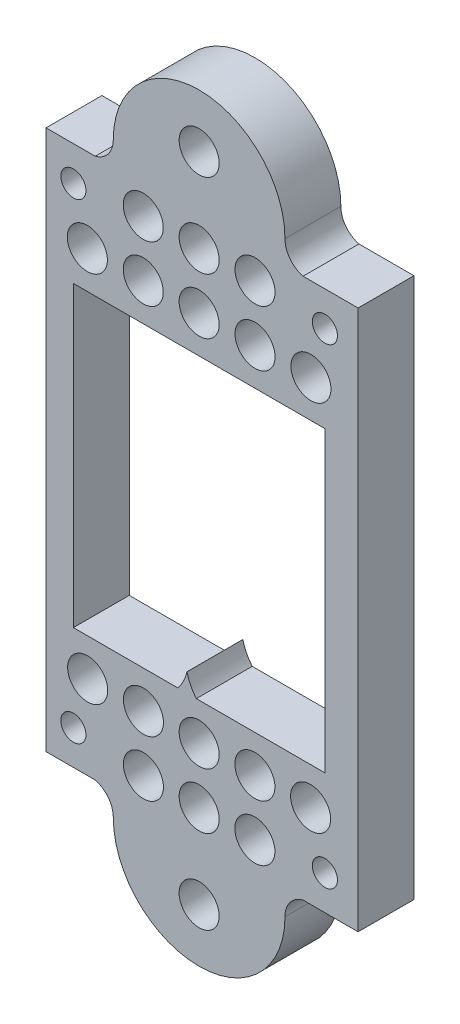
from build123d import *

# Parameters (mm, degrees)
SKETCH1_R           = 1.35
SKETCH1_R_2         = 2.15
BOSS_EXTRUDE1_DEPTH = 6
SKETCH2_R           = 2.15
CUT_EXTRUDE1_DEPTH  = 4.2


with BuildPart() as part:
    # Sketch1 → Boss-Extrude1 (new body)
    with BuildSketch(Plane.XY):
        with BuildLine():
            Line((-16.436457619, 29), (-11.155935204, 29))
            ThreePointArc((-11.155935204, 29), (-9.748616749, 29.926511277), (-9.214880919, 31.524664725))
            ThreePointArc((-9.214880919, 31.524664725), (0, 40.739545643), (9.214880919, 31.524664725))
            ThreePointArc((9.214880919, 31.524664725), (9.748616749, 29.926511277), (11.155935204, 29))
            Line((11.155935204, 29), (17.063542381, 29))
            Line((17.063542381, 29), (17.063542381, -29))
            Line((17.063542381, -29), (11.155935204, -29))
            ThreePointArc((11.155935204, -29), (9.748616749, -29.926511277), (9.214880919, -31.524664725))
            ThreePointArc((9.214880919, -31.524664725), (0, -40.739545643), (-9.214880919, -31.524664725))
            ThreePointArc((-9.214880919, -31.524664725), (-9.748616749, -29.926511277), (-11.155935204, -29))
            Line((-11.155935204, -29), (-16.436457619, -29))
            Line((-16.436457619, -29), (-16.436457619, 29))
        make_face()
        with Locations((-13.5, 25.3)):
            Circle(SKETCH1_R, mode=Mode.SUBTRACT)
        with Locations((13.5, -25.3)):
            Circle(SKETCH1_R, mode=Mode.SUBTRACT)
        with Locations((-13.5, -25.3)):
            Circle(SKETCH1_R, mode=Mode.SUBTRACT)
        with Locations((13.5, 25.3)):
            Circle(SKETCH1_R, mode=Mode.SUBTRACT)
        with Locations((0, 35)):
            Circle(SKETCH1_R_2, mode=Mode.SUBTRACT)
        with Locations(Location((0, -35, 0), (0, 0, 180))):
            Circle(SKETCH1_R_2, mode=Mode.SUBTRACT)
        with BuildLine():
            Line((-13.5, 16), (13.5, 16))
            Line((13.5, 16), (13.5, -16))
            Line((13.5, -16), (-0.3, -16))
            ThreePointArc((-0.3, -16), (-0.921986523, -15.060993262), (-1.3, -14))
            ThreePointArc((-1.3, -14), (-1.678013477, -15.060993262), (-2.3, -16))
            Line((-2.3, -16), (-13.5, -16))
            Line((-13.5, -16), (-13.5, 16))
        make_face(mode=Mode.SUBTRACT)
    extrude(amount=BOSS_EXTRUDE1_DEPTH)

    # Sketch2 → Cut-Extrude1 (cut)
    with BuildSketch(Plane.XY.offset(6)):
        with Locations((-12, 20)):
            Circle(SKETCH2_R)
        with Locations((-6, 20)):
            Circle(SKETCH2_R)
        with Locations((0, 20)):
            Circle(SKETCH2_R)
        with Locations((6, 20)):
            Circle(SKETCH2_R)
        with Locations((12, 20)):
            Circle(SKETCH2_R)
        with Locations((-6, 26)):
            Circle(SKETCH2_R)
        with Locations((0, 26)):
            Circle(SKETCH2_R)
        with Locations((6, 26)):
            Circle(SKETCH2_R)
        with Locations((-11.967349369, -20)):
            Circle(SKETCH2_R)
        with Locations((-5.983674685, -20)):
            Circle(SKETCH2_R)
        with Locations((0, -20)):
            Circle(SKETCH2_R)
        with Locations((5.983674685, -20)):
            Circle(SKETCH2_R)
        with Locations((11.967349369, -20)):
            Circle(SKETCH2_R)
        with Locations((-5.983674685, -26)):
            Circle(SKETCH2_R)
        with Locations((0, -26)):
            Circle(SKETCH2_R)
        with Locations((5.983674685, -26)):
            Circle(SKETCH2_R)
    extrude(amount=-CUT_EXTRUDE1_DEPTH, mode=Mode.SUBTRACT)


solid = part.part
